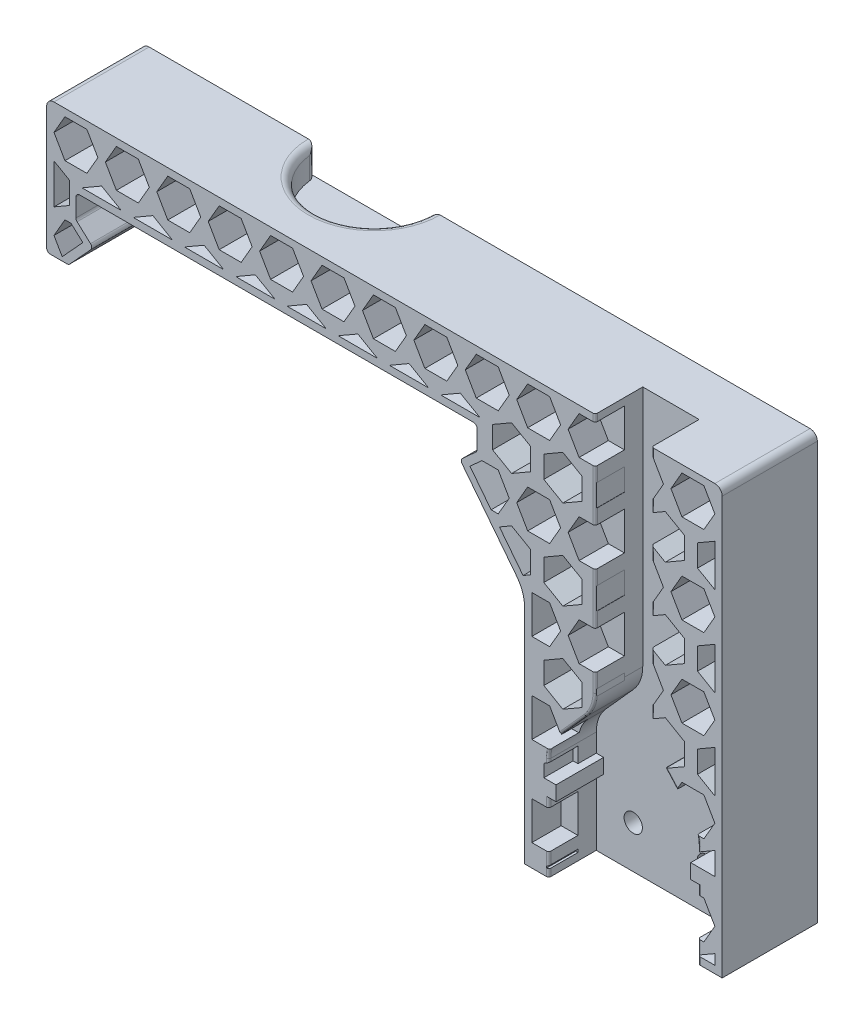
from build123d import *

# Parameters (mm, degrees)
BOSS_EXTRUDE1_DEPTH = 6.5
SKETCH2_R           = 8
CUT_EXTRUDE1_DEPTH  = 4
FILLET1_R           = 1
SKETCH3_R           = 1.25
CUT_EXTRUDE2_DEPTH  = 6.5
SKETCH4_R           = 1.25
CUT_EXTRUDE3_DEPTH  = 10
FILLET2_R           = 0.3
SKETCH5_W           = 2
SKETCH5_H           = 5.196152423
CUT_EXTRUDE4_DEPTH  = 4
BOSS_EXTRUDE2_DEPTH = 4
BOSS_EXTRUDE3_DEPTH = 4


with BuildPart() as part:
    # Sketch1 → Boss-Extrude1 (new, symmetric)
    with BuildSketch(Plane.XY):
        with BuildLine():
            Line((-30.4, 19.735587343), (59.88, 19.735587343))
            ThreePointArc((59.88, 19.735587343), (60.587106781, 19.442694124), (60.88, 18.735587343))
            Line((60.88, 18.735587343), (60.88, -38.264412657))
            Line((60.88, -38.264412657), (33.88, -38.264412657))
            Line((33.88, -38.264412657), (33.88, -7.853499309))
            ThreePointArc((33.88, -7.853499309), (33.608160814, -6.227308877), (32.822201872, -4.777943359))
            Line((32.822201872, -4.777943359), (25.380111772, 4.761217038))
            ThreePointArc((25.380111772, 4.761217038), (25.24922633, 5.120821836), (25.410955337, 5.467650811))
            Line((25.410955337, 5.467650811), (27.237795104, 7.141641039))
            ThreePointArc((27.237795104, 7.141641039), (27.35765574, 7.308906363), (27.4, 7.510279708))
            Line((27.4, 7.510279708), (27.4, 9.990274442))
            ThreePointArc((27.4, 9.990274442), (27.253553391, 10.343827833), (26.9, 10.490274442))
            Line((26.9, 10.490274442), (-26.9, 10.490274442))
            ThreePointArc((-26.9, 10.490274442), (-27.253553391, 10.343827833), (-27.4, 9.990274442))
            Line((-27.4, 9.990274442), (-27.4, 7.510279708))
            ThreePointArc((-27.4, 7.510279708), (-27.35765574, 7.308906363), (-27.237795104, 7.141641039))
            Line((-27.237795104, 7.141641039), (-25.410955337, 5.467650811))
            ThreePointArc((-25.410955337, 5.467650811), (-25.24922633, 5.120821836), (-25.380111772, 4.761217038))
            Line((-25.380111772, 4.761217038), (-28.251366597, 1.627792239))
            ThreePointArc((-28.251366597, 1.627792239), (-28.418631921, 1.507931603), (-28.620005265, 1.465587343))
            Line((-28.620005265, 1.465587343), (-30.9, 1.465587343))
            ThreePointArc((-30.9, 1.465587343), (-31.253553391, 1.612033952), (-31.4, 1.965587343))
            Line((-31.4, 1.965587343), (-31.4, 18.735587343))
            ThreePointArc((-31.4, 18.735587343), (-31.107106781, 19.442694124), (-30.4, 19.735587343))
        make_face()
    extrude(amount=BOSS_EXTRUDE1_DEPTH, both=True)

    # Sketch2 → Cut-Extrude1 (cut)
    with BuildSketch(Plane(origin=(0, 19.735587343, 0), x_dir=(1, 0, 0), z_dir=(0, 1, 0))):
        with Locations((0.35, 6.5)):
            Circle(SKETCH2_R)
    extrude(amount=-CUT_EXTRUDE1_DEPTH, mode=Mode.SUBTRACT)

    # Fillet1
    fillet1_edges = [part.edges().sort_by_distance(p)[0] for p in [
        (-7.65, 17.735587343, -6.5),
        (8.35, 17.735587343, -6.5),
        (0.35, 19.735587343, 1.5),
    ]]
    fillet(fillet1_edges, radius=FILLET1_R)

    # Sketch3 → Cut-Extrude2 (cut)
    with BuildSketch(Plane.XY.offset(6.5)):
        with BuildLine():
            Line((51.23, 19.735587343), (43.53, 19.735587343))
            Line((43.53, 19.735587343), (43.53, -13.351597797))
            ThreePointArc((43.53, -13.351597797), (43.199931906, -15.138140826), (42.253305602, -16.688811514))
            Line((42.253305602, -16.688811514), (38.456694398, -20.924663626))
            ThreePointArc((38.456694398, -20.924663626), (37.510068094, -22.475334314), (37.18, -24.261877343))
            Line((37.18, -24.261877343), (37.18, -26.764412657))
            Line((37.18, -26.764412657), (38.18, -26.764412657))
            Line((38.18, -26.764412657), (38.18, -28.764412657))
            Line((38.18, -28.764412657), (37.18, -28.764412657))
            Line((37.18, -28.764412657), (37.18, -38.264412657))
            Line((37.18, -38.264412657), (57.58, -38.264412657))
            Line((57.58, -38.264412657), (57.58, -28.764412657))
            Line((57.58, -28.764412657), (56.58, -28.764412657))
            Line((56.58, -28.764412657), (56.58, -26.764412657))
            Line((56.58, -26.764412657), (57.58, -26.764412657))
            Line((57.58, -26.764412657), (57.58, -24.261877343))
            ThreePointArc((57.58, -24.261877343), (57.249931906, -22.475334314), (56.303305602, -20.924663626))
            Line((56.303305602, -20.924663626), (52.506694398, -16.688811514))
            ThreePointArc((52.506694398, -16.688811514), (51.560068094, -15.138140826), (51.23, -13.351597797))
            Line((51.23, -13.351597797), (51.23, 19.735587343))
        make_face()
        with Locations((42.23, -32.464412657)):
            Circle(SKETCH3_R, mode=Mode.SUBTRACT)
        with Locations((52.23, -32.464412657)):
            Circle(SKETCH3_R, mode=Mode.SUBTRACT)
    extrude(amount=-CUT_EXTRUDE2_DEPTH, mode=Mode.SUBTRACT)

    # Sketch4 → Cut-Extrude3 (cut)
    with BuildSketch(Plane.XY.offset(6.5)):
        with Locations((42.23, -32.464412657)):
            Circle(SKETCH4_R)
        with Locations((52.23, -32.464412657)):
            Circle(SKETCH4_R)
    extrude(amount=-CUT_EXTRUDE3_DEPTH, mode=Mode.SUBTRACT)

    # Fillet2
    fillet2_edges = [part.edges().sort_by_distance(p)[0] for p in [
        (37.510068094, -22.475334314, 6.5),
        (43.199931906, -15.138140826, 6.5),
        (51.23, 3.191994773, 6.5),
        (54.405, -18.80673757, 6.5),
        (37.18, -33.514412657, 6.5),
        (37.18, -25.513145, 6.5),
        (57.58, -33.514412657, 6.5),
        (57.58, -25.513145, 6.5),
        (57.249931906, -22.475334314, 6.5),
        (51.560068094, -15.138140826, 6.5),
        (43.53, 3.191994773, 6.5),
        (40.355, -18.80673757, 6.5),
    ]]
    fillet(fillet2_edges, radius=FILLET2_R)

    # Sketch5 → Cut-Extrude4 (cut)
    with BuildSketch(Plane.XY.offset(6.5)):
        Polygon((-30.4, 16.137511132), (-28.9, 13.53943492), (-25.9, 13.53943492), (-24.4, 16.137511132), (-25.9, 18.735587343), (-28.9, 18.735587343), align=None)
        Polygon((-23.376666667, 16.137511132), (-21.876666667, 13.53943492), (-18.876666667, 13.53943492), (-17.376666667, 16.137511132), (-18.876666667, 18.735587343), (-21.876666667, 18.735587343), align=None)
        Polygon((-28.290257122, 11.53943492), (-30.4, 12.757495539), (-30.4, 7.321374302), (-28.290257122, 8.53943492), align=None)
        Polygon((-26.455184213, 5.068168578), (-29.274319281, 1.991622511), (-30.4, 3.941358709), (-28.9, 6.53943492), (-28.06078968, 6.53943492), align=None)
        Polygon((-26.486409545, 11.53943492), (-26.486409545, 11.490274442), (-21.290257122, 11.490274442), (-21.290257122, 11.53943492), (-23.888333333, 13.03943492), align=None)
        Polygon((-19.486409545, 11.53943492), (-19.486409545, 11.490274442), (-14.290257122, 11.490274442), (-14.290257122, 11.53943492), (-16.888333333, 13.03943492), align=None)
        Polygon((-16.353333333, 16.137511132), (-14.853333333, 13.53943492), (-11.853333333, 13.53943492), (-10.353333333, 16.137511132), (-11.853333333, 18.735587343), (-14.853333333, 18.735587343), align=None)
        Polygon((-12.486409545, 11.53943492), (-12.486409545, 11.490274442), (-7.290257122, 11.490274442), (-7.290257122, 11.53943492), (-9.888333333, 13.03943492), align=None)
        Polygon((-9.33, 16.137511132), (-7.83, 13.53943492), (-4.83, 13.53943492), (-3.33, 16.137511132), (-4.83, 18.735587343), (-7.83, 18.735587343), align=None)
        Polygon((-5.486409545, 11.53943492), (-5.486409545, 11.490274442), (-0.290257122, 11.490274442), (-0.290257122, 11.53943492), (-2.888333333, 13.03943492), align=None)
        Polygon((1.513590455, 11.53943492), (1.513590455, 11.490274442), (6.709742878, 11.490274442), (6.709742878, 11.53943492), (4.111666667, 13.03943492), align=None)
        Polygon((8.513590455, 11.53943492), (8.513590455, 11.490274442), (13.709742878, 11.490274442), (13.709742878, 11.53943492), (11.111666667, 13.03943492), align=None)
        Polygon((15.513590455, 11.53943492), (15.513590455, 11.490274442), (20.709742878, 11.490274442), (20.709742878, 11.53943492), (18.111666667, 13.03943492), align=None)
        Polygon((22.513590455, 11.53943492), (22.513590455, 11.490274442), (27.709742878, 11.490274442), (27.709742878, 11.53943492), (25.111666667, 13.03943492), align=None)
        Polygon((25.786666667, 16.137511132), (27.286666667, 13.53943492), (30.286666667, 13.53943492), (31.786666667, 16.137511132), (30.286666667, 18.735587343), (27.286666667, 18.735587343), align=None)
        Polygon((18.763333333, 16.137511132), (20.263333333, 13.53943492), (23.263333333, 13.53943492), (24.763333333, 16.137511132), (23.263333333, 18.735587343), (20.263333333, 18.735587343), align=None)
        Polygon((11.74, 16.137511132), (13.24, 13.53943492), (16.24, 13.53943492), (17.74, 16.137511132), (16.24, 18.735587343), (13.24, 18.735587343), align=None)
        Polygon((4.716666667, 16.137511132), (6.216666667, 13.53943492), (9.216666667, 13.53943492), (10.716666667, 16.137511132), (9.216666667, 18.735587343), (6.216666667, 18.735587343), align=None)
        Polygon((-2.306666667, 16.137511132), (-0.806666667, 13.53943492), (2.193333333, 13.53943492), (3.693333333, 16.137511132), (2.193333333, 18.735587343), (-0.806666667, 18.735587343), align=None)
        Polygon((32.81, 16.137511132), (34.31, 13.53943492), (37.31, 13.53943492), (38.81, 16.137511132), (37.31, 18.735587343), (34.31, 18.735587343), align=None)
        Polygon((29.513590455, 11.53943492), (29.513590455, 8.53943492), (32.111666667, 7.03943492), (34.709742878, 8.53943492), (34.709742878, 11.53943492), (32.111666667, 13.03943492), align=None)
        Polygon((36.513590455, 11.53943492), (36.513590455, 8.53943492), (39.111666667, 7.03943492), (41.709742878, 8.53943492), (41.709742878, 11.53943492), (39.111666667, 13.03943492), align=None)
        Polygon((41.333333333, 13.53943492), (43.23, 13.53943492), (43.23, 18.735587343), (41.333333333, 18.735587343), (39.833333333, 16.137511132), align=None)
        Polygon((43.513590455, 11.53943492), (43.513590455, 8.53943492), (46.111666667, 7.03943492), (48.709742878, 8.53943492), (48.709742878, 11.53943492), (46.111666667, 13.03943492), align=None)
        Polygon((46.856666667, 16.137511132), (48.356666667, 13.53943492), (51.356666667, 13.53943492), (52.856666667, 16.137511132), (51.356666667, 18.735587343), (48.356666667, 18.735587343), align=None)
        Polygon((50.513590455, 11.53943492), (50.513590455, 8.53943492), (53.111666667, 7.03943492), (55.709742878, 8.53943492), (55.709742878, 11.53943492), (53.111666667, 13.03943492), align=None)
        Polygon((53.88, 16.137511132), (55.38, 13.53943492), (58.38, 13.53943492), (59.88, 16.137511132), (58.38, 18.735587343), (55.38, 18.735587343), align=None)
        Polygon((43.23, 13.53943492), (44.333333333, 13.53943492), (45.833333333, 16.137511132), (44.333333333, 18.735587343), (43.23, 18.735587343), align=None)
        Polygon((59.88, 12.905682108), (59.88, 7.173187733), (57.513590455, 8.53943492), (57.513590455, 11.53943492), align=None)
        Polygon((53.88, 3.941358709), (55.38, 1.343282497), (58.38, 1.343282497), (59.88, 3.941358709), (58.38, 6.53943492), (55.38, 6.53943492), align=None)
        Polygon((46.856666667, 3.941358709), (48.356666667, 1.343282497), (51.356666667, 1.343282497), (52.856666667, 3.941358709), (51.356666667, 6.53943492), (48.356666667, 6.53943492), align=None)
        Polygon((43.23, 1.343282497), (43.23, 6.53943492), (41.333333333, 6.53943492), (39.833333333, 3.941358709), (41.333333333, 1.343282497), align=None)
        Polygon((32.81, 3.941358709), (34.31, 1.343282497), (37.31, 1.343282497), (38.81, 3.941358709), (37.31, 6.53943492), (34.31, 6.53943492), align=None)
        Polygon((26.425209935, 5.047348092), (28.06078968, 6.53943492), (30.286666667, 6.53943492), (31.786666667, 3.941358709), (30.286666667, 1.343282497), (29.31498102, 1.343282497), align=None)
        Polygon((44.333333333, 6.53943492), (43.23, 6.53943492), (43.23, 1.343282497), (44.333333333, 1.343282497), (45.833333333, 3.941358709), align=None)
        Polygon((32.111666667, 0.843282497), (30.452427608, -0.11467962), (33.679734244, -4.251393265), (34.709742878, -3.656717503), (34.709742878, -0.656717503), align=None)
        Polygon((36.513590455, -0.656717503), (36.513590455, -3.656717503), (39.111666667, -5.156717503), (41.709742878, -3.656717503), (41.709742878, -0.656717503), (39.111666667, 0.843282497), align=None)
        Polygon((43.513590455, -0.656717503), (43.513590455, -3.656717503), (46.111666667, -5.156717503), (48.709742878, -3.656717503), (48.709742878, -0.656717503), (46.111666667, 0.843282497), align=None)
        Polygon((50.513590455, -0.656717503), (50.513590455, -3.656717503), (53.111666667, -5.156717503), (55.709742878, -3.656717503), (55.709742878, -0.656717503), (53.111666667, 0.843282497), align=None)
        Polygon((59.88, 0.709529685), (59.88, -5.02296469), (57.513590455, -3.656717503), (57.513590455, -0.656717503), align=None)
        Polygon((53.88, -8.254793714), (55.38, -10.852869925), (58.38, -10.852869925), (59.88, -8.254793714), (58.38, -5.656717503), (55.38, -5.656717503), align=None)
        Polygon((46.856666667, -8.254793714), (48.356666667, -10.852869925), (51.356666667, -10.852869925), (52.856666667, -8.254793714), (51.356666667, -5.656717503), (48.356666667, -5.656717503), align=None)
        Polygon((44.333333333, -5.656717503), (43.23, -5.656717503), (43.23, -10.852869925), (44.333333333, -10.852869925), (45.833333333, -8.254793714), align=None)
        Polygon((43.23, -10.852869925), (43.23, -5.656717503), (41.333333333, -5.656717503), (39.833333333, -8.254793714), (41.333333333, -10.852869925), align=None)
        Polygon((37.31, -5.656717503), (34.88, -5.656717503), (34.88, -10.852869925), (37.31, -10.852869925), (38.81, -8.254793714), align=None)
        Polygon((36.513590455, -12.852869925), (36.513590455, -15.852869925), (39.111666667, -17.352869925), (41.709742878, -15.852869925), (41.709742878, -12.852869925), (39.111666667, -11.352869925), align=None)
        Polygon((43.513590455, -12.852869925), (43.513590455, -15.852869925), (46.111666667, -17.352869925), (48.709742878, -15.852869925), (48.709742878, -12.852869925), (46.111666667, -11.352869925), align=None)
        Polygon((50.513590455, -12.852869925), (50.513590455, -15.852869925), (53.111666667, -17.352869925), (55.709742878, -15.852869925), (55.709742878, -12.852869925), (53.111666667, -11.352869925), align=None)
        Polygon((59.88, -11.486622738), (59.88, -17.219117113), (57.513590455, -15.852869925), (57.513590455, -12.852869925), align=None)
        Polygon((53.88, -20.450946137), (55.38, -23.049022348), (58.38, -23.049022348), (59.88, -20.450946137), (58.38, -17.852869925), (55.38, -17.852869925), align=None)
        Polygon((46.856666667, -20.450946137), (48.356666667, -23.049022348), (51.356666667, -23.049022348), (52.856666667, -20.450946137), (51.356666667, -17.852869925), (48.356666667, -17.852869925), align=None)
        Polygon((39.833333333, -20.450946137), (41.333333333, -23.049022348), (44.333333333, -23.049022348), (45.833333333, -20.450946137), (44.333333333, -17.852869925), (41.333333333, -17.852869925), align=None)
        with BuildLine():
            Line((38.233296061, -20.724430803), (38.680093711, -20.225941844))
            Line((38.680093711, -20.225941844), (37.31, -17.852869925))
            Line((37.31, -17.852869925), (34.88, -17.852869925))
            Line((34.88, -17.852869925), (34.88, -23.049022348))
            Line((34.88, -23.049022348), (37.020641245, -23.049022348))
            ThreePointArc((37.020641245, -23.049022348), (37.480954788, -21.810556455), (38.233296061, -20.724430803))
        make_face()
        with BuildLine():
            Line((37.31, -23.049022348), (38.81, -20.450946137))
            Line((38.81, -20.450946137), (38.680093711, -20.225941844))
            Line((38.680093711, -20.225941844), (38.233296061, -20.724430803))
            ThreePointArc((38.233296061, -20.724430803), (37.480954788, -21.810556455), (37.020641245, -23.049022348))
            Line((37.020641245, -23.049022348), (37.31, -23.049022348))
        make_face()
        Polygon((39.111666667, -23.549022348), (36.88, -24.837475699), (36.88, -26.764412657), (38.18, -26.764412657), (38.18, -28.764412657), (37.752682818, -28.764412657), (39.111666667, -29.549022348), (41.709742878, -28.049022348), (41.709742878, -25.049022348), align=None)
        Polygon((36.88, -26.764412657), (36.88, -24.837475699), (36.513590455, -25.049022348), (36.513590455, -28.049022348), (37.752682818, -28.764412657), (38.18, -28.764412657), (38.18, -26.764412657), align=None)
        Polygon((43.513590455, -25.049022348), (43.513590455, -28.049022348), (46.111666667, -29.549022348), (48.709742878, -28.049022348), (48.709742878, -25.049022348), (46.111666667, -23.549022348), align=None)
        Polygon((50.513590455, -25.049022348), (50.513590455, -28.049022348), (53.111666667, -29.549022348), (55.709742878, -28.049022348), (55.709742878, -25.049022348), (53.111666667, -23.549022348), align=None)
        Polygon((59.88, -23.68277516), (59.88, -29.415269536), (57.513590455, -28.049022348), (57.513590455, -25.049022348), align=None)
        Polygon((53.88, -32.647098559), (55.38, -35.245174771), (58.38, -35.245174771), (59.88, -32.647098559), (58.38, -30.049022348), (55.38, -30.049022348), align=None)
        Polygon((46.856666667, -32.647098559), (48.356666667, -35.245174771), (51.356666667, -35.245174771), (52.856666667, -32.647098559), (51.356666667, -30.049022348), (48.356666667, -30.049022348), align=None)
        Polygon((39.833333333, -32.647098559), (41.333333333, -35.245174771), (44.333333333, -35.245174771), (45.833333333, -32.647098559), (44.333333333, -30.049022348), (41.333333333, -30.049022348), align=None)
        Polygon((37.31, -30.049022348), (36.88, -30.049022348), (36.88, -35.245174771), (37.31, -35.245174771), (38.81, -32.647098559), align=None)
        with Locations((35.88, -32.64709856)):
            Rectangle(SKETCH5_W, SKETCH5_H)
        Polygon((39.111666667, -35.745174771), (36.88, -37.033628121), (36.88, -37.264412657), (41.709742878, -37.264412657), (41.709742878, -37.245174771), align=None)
        Polygon((43.513590455, -37.245174771), (43.513590455, -37.264412657), (48.709742878, -37.264412657), (48.709742878, -37.245174771), (46.111666667, -35.745174771), align=None)
        Polygon((50.513590455, -37.245174771), (50.513590455, -37.264412657), (55.709742878, -37.264412657), (55.709742878, -37.245174771), (53.111666667, -35.745174771), align=None)
        Polygon((57.513590455, -37.245174771), (57.513590455, -37.264412657), (59.88, -37.264412657), (59.88, -35.878927583), align=None)
    extrude(amount=-CUT_EXTRUDE4_DEPTH, mode=Mode.SUBTRACT)

    # Sketch7 → Boss-Extrude2 (add)
    with BuildSketch(Plane.XY.offset(2.5)):
        Polygon((38.18, -26.764412657), (38.18, -28.764412657), (37.752682818, -28.764412657), (36.513590455, -28.049022348), (36.513590455, -26.764412657), align=None)
    extrude(amount=BOSS_EXTRUDE2_DEPTH)

    # Sketch8 → Boss-Extrude3 (add)
    with BuildSketch(Plane.XY.offset(2.5)):
        Polygon((57.58, -26.764412657), (57.513590455, -26.764412657), (57.513590455, -28.049022348), (59.88, -29.415269536), (59.88, -26.764412657), align=None)
    extrude(amount=BOSS_EXTRUDE3_DEPTH)


solid = part.part
